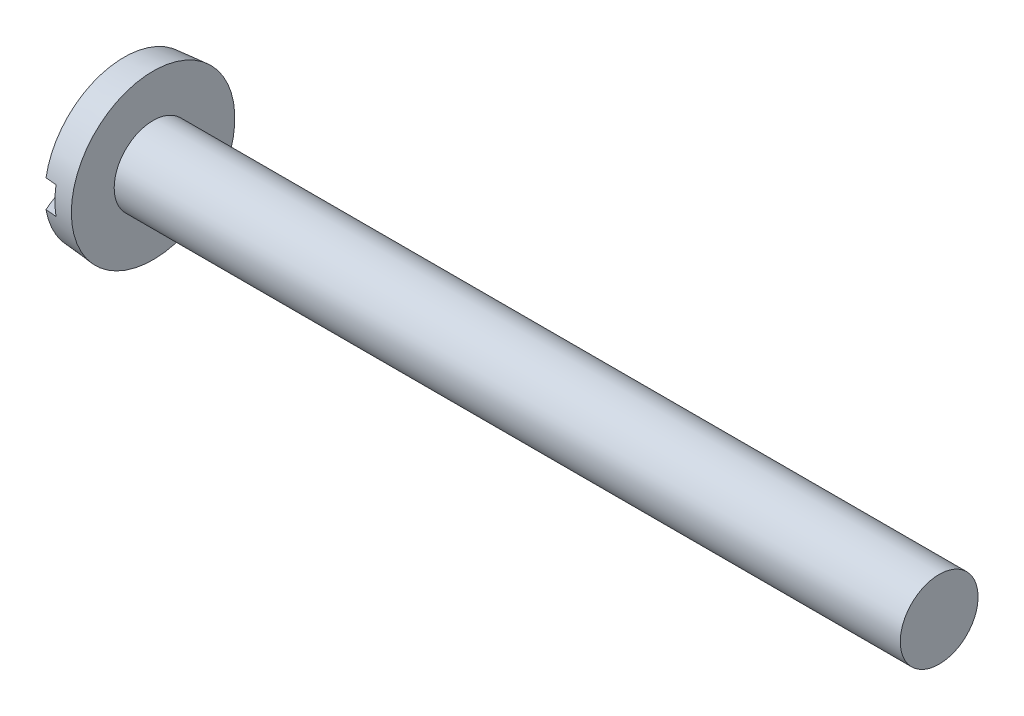
from build123d import *

# Parameters (mm, degrees)
SKETCH2_W  = 5.2832
SKETCH2_H  = 0.889
SLOT_DEPTH = 0.9144


with BuildPart() as part:
    # BodySke → Base-Revolve (revolve)
    with BuildSketch(Plane.XY, mode=Mode.PRIVATE) as base_revolve_sk:
        with BuildLine():
            Line((1.4986, 1.2573), (1.4986, 2.6416))
            Line((1.4986, 2.6416), (0.5588, 2.559378154))
            ThreePointArc((0.5588, 2.559378154), (0.141326332, 1.309835293), (0, 0))
            Line((0, 0), (26.8986, 0))
            Line((26.8986, 0), (26.8986, 1.2573))
            Line((26.8986, 1.2573), (1.4986, 1.2573))
        make_face()
    revolve(base_revolve_sk.sketch.rotate(Axis((-25.4, 0, 0), (1, 0, 0)), 90), axis=Axis((-25.4, 0, 0), (1, 0, 0)))

    # Sketch2 → Slot (cut)
    with BuildSketch(Plane(origin=(0, 0, 0), x_dir=(0, 0, -1), z_dir=(1, 0, 0))):
        Rectangle(SKETCH2_W, SKETCH2_H)
    extrude(amount=SLOT_DEPTH, mode=Mode.SUBTRACT)


solid = part.part
